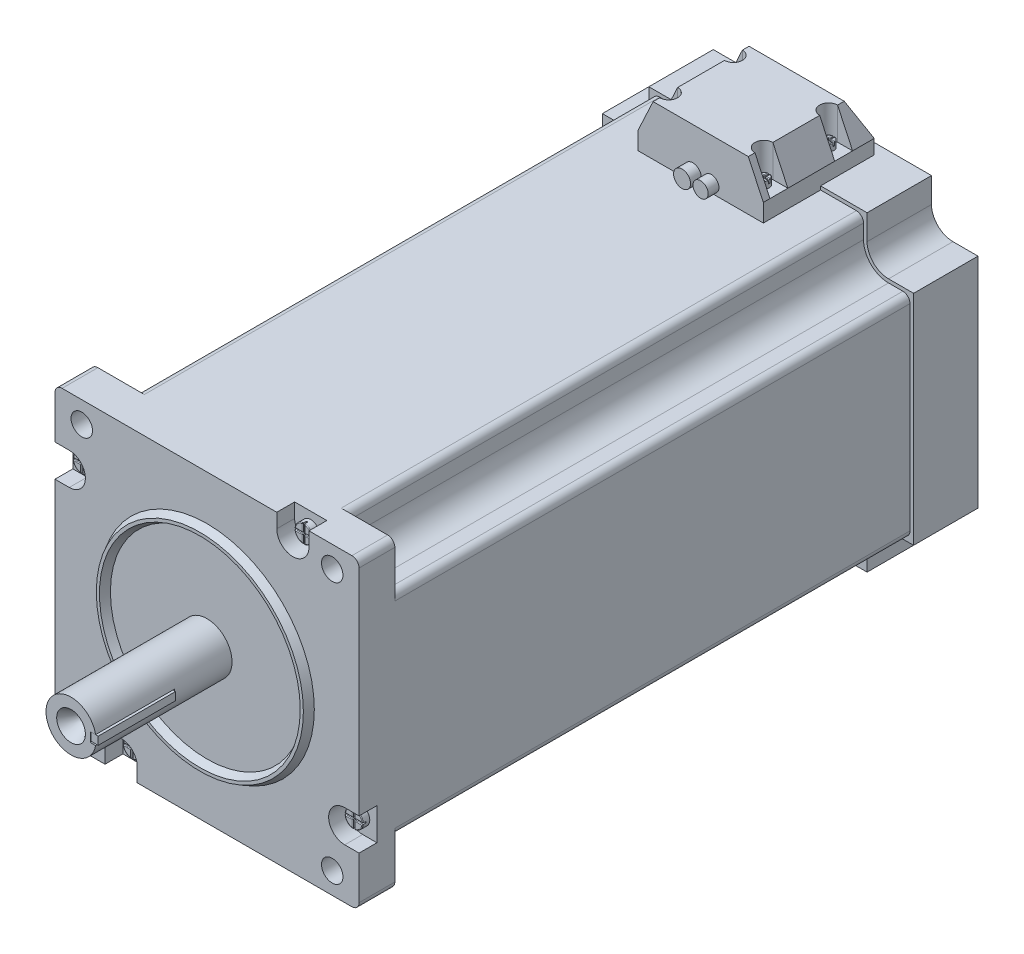
from build123d import *

# Parameters (mm, degrees)
BOSS_EXTRUDE1_DEPTH  = 144
BOSS_EXTRUDE2_START  = 18
BOSS_EXTRUDE2_DEPTH  = 18
SKETCH4_W            = 85
SKETCH4_H            = 85
BOSS_EXTRUDE3_DEPTH  = 10
SKETCH5_R            = 3
CUT_EXTRUDE1_DEPTH   = 10
CUT_EXTRUDE2_DEPTH   = 5
SKETCH7_R            = 30
SKETCH7_R_2          = 27
BOSS_EXTRUDE4_DEPTH  = 2
BOSS_EXTRUDE4_DRAFT  = 28
SKETCH8_R            = 7
BOSS_EXTRUDE5_DEPTH  = 38
SKETCH9_R            = 4.014569365
CUT_EXTRUDE3_DEPTH   = 5
CUT_EXTRUDE3_DRAFT   = -32
SKETCH10_W           = 1.908074337
SKETCH10_H           = 2.63882621
CUT_EXTRUDE4_DEPTH   = 22
SKETCH11_W           = 21.6
SKETCH11_H           = 2.23882621
BOSS_EXTRUDE6_DEPTH  = 2
FILLET1_R            = 2
FILLET2_R            = 2
SKETCH12_R           = 2.5
BOSS_EXTRUDE7_DEPTH  = 2
CUT_EXTRUDE5_START   = -1
CUT_EXTRUDE5_DEPTH   = 1
FILLET3_R            = 0.2
SKETCH14_W           = 35
SKETCH14_H           = 31
BOSS_EXTRUDE8_DEPTH  = 5
SKETCH15_W           = 35
SKETCH15_H           = 31
BOSS_EXTRUDE9_DEPTH  = 9
BOSS_EXTRUDE9_TAPER  = 25
BOSS_EXTRUDE10_REACH = 234.938
SKETCH16_W           = 35
SKETCH16_H           = 4.196768923
CUT_EXTRUDE6_DEPTH   = 4.196768923
SKETCH18_R           = 2.5
CUT_EXTRUDE7_DEPTH   = 9
SKETCH19_W           = 4.524890729
SKETCH19_H           = 5
SKETCH19_W_2         = 5.286669256
SKETCH19_W_3         = 5.176854747
SKETCH19_W_4         = 5.679294717
CUT_EXTRUDE8_DEPTH   = 9
SKETCH20_R           = 1.5
BOSS_EXTRUDE11_DEPTH = 2
CUT_EXTRUDE9_START   = -1
CUT_EXTRUDE9_DEPTH   = 1
FILLET4_R            = 0.2
SKETCH22_R           = 2.372641089
SKETCH22_R_2         = 2.128578972
BOSS_EXTRUDE12_DEPTH = 3


with BuildPart() as part:
    # Sketch1 → Boss-Extrude1 (new body)
    with BuildSketch(Plane.XY):
        with BuildLine():
            Line((13, 0), (72, 0))
            Line((72, 0), (72, 6))
            ThreePointArc((72, 6), (74.050252532, 10.949747468), (79, 13))
            Line((79, 13), (85, 13))
            Line((85, 13), (85, 72))
            Line((85, 72), (79, 72))
            ThreePointArc((79, 72), (74.050252532, 74.050252532), (72, 79))
            Line((72, 79), (72, 85))
            Line((72, 85), (13, 85))
            Line((13, 85), (13, 79))
            ThreePointArc((13, 79), (10.949747468, 74.050252532), (6, 72))
            Line((6, 72), (0, 72))
            Line((0, 72), (0, 13))
            Line((0, 13), (6, 13))
            ThreePointArc((6, 13), (10.949747468, 10.949747468), (13, 6))
            Line((13, 6), (13, 0))
        make_face()
    extrude(amount=BOSS_EXTRUDE1_DEPTH)

    # Sketch2 → Boss-Extrude2 (add)
    # profile 1 of 2: a face of its own
    with BuildSketch(Plane(origin=(0, 0, 0), x_dir=(-1, 0, 0), z_dir=(0, 0, -1)).offset(BOSS_EXTRUDE2_START)):
        with BuildLine():
            ThreePointArc((-6, 12), (-10.242640687, 10.242640687), (-12, 6))
            Line((-12, 6), (-12, -1))
            Line((-12, -1), (-73, -1))
            Line((-73, -1), (-73, 6))
            ThreePointArc((-73, 6), (-74.757359313, 10.242640687), (-79, 12))
            Line((-79, 12), (-86, 12))
            Line((-86, 12), (-86, 73))
            Line((-86, 73), (-79, 73))
            ThreePointArc((-79, 73), (-74.757359313, 74.757359313), (-73, 79))
            Line((-73, 79), (-73, 86))
            Line((-73, 86), (-12, 86))
            Line((-12, 86), (-12, 79))
            ThreePointArc((-12, 79), (-10.242640687, 74.757359313), (-6, 73))
            Line((-6, 73), (1, 73))
            Line((1, 73), (1, 12))
            Line((1, 12), (-6, 12))
        make_face()
        with BuildLine():
            Line((0, 72), (-6, 72))
            ThreePointArc((-6, 72), (-10.949747468, 74.050252532), (-13, 79))
            Line((-13, 79), (-13, 85))
            Line((-13, 85), (-72, 85))
            Line((-72, 85), (-72, 79))
            ThreePointArc((-72, 79), (-74.050252532, 74.050252532), (-79, 72))
            Line((-79, 72), (-85, 72))
            Line((-85, 72), (-85, 13))
            Line((-85, 13), (-79, 13))
            ThreePointArc((-79, 13), (-74.050252532, 10.949747468), (-72, 6))
            Line((-72, 6), (-72, 0))
            Line((-72, 0), (-13, 0))
            Line((-13, 0), (-13, 6))
            ThreePointArc((-13, 6), (-10.949747468, 10.949747468), (-6, 13))
            Line((-6, 13), (0, 13))
            Line((0, 13), (0, 72))
        make_face(mode=Mode.SUBTRACT)
    # profile 2 of 2: a face of its own
    with BuildSketch(Plane(origin=(0, 0, 0), x_dir=(-1, 0, 0), z_dir=(0, 0, -1)).offset(BOSS_EXTRUDE2_START)):
        with BuildLine():
            Line((0, 13), (0, 72))
            Line((0, 72), (-6, 72))
            ThreePointArc((-6, 72), (-10.949747468, 74.050252532), (-13, 79))
            Line((-13, 79), (-13, 85))
            Line((-13, 85), (-72, 85))
            Line((-72, 85), (-72, 79))
            ThreePointArc((-72, 79), (-74.050252532, 74.050252532), (-79, 72))
            Line((-79, 72), (-85, 72))
            Line((-85, 72), (-85, 13))
            Line((-85, 13), (-79, 13))
            ThreePointArc((-79, 13), (-74.050252532, 10.949747468), (-72, 6))
            Line((-72, 6), (-72, 0))
            Line((-72, 0), (-13, 0))
            Line((-13, 0), (-13, 6))
            ThreePointArc((-13, 6), (-10.949747468, 10.949747468), (-6, 13))
            Line((-6, 13), (0, 13))
        make_face()
    extrude(amount=-BOSS_EXTRUDE2_DEPTH)

    # Sketch4 → Boss-Extrude3 (add)
    with BuildSketch(Plane.XY.offset(144)):
        with Locations((42.5, 42.5)):
            Rectangle(SKETCH4_W, SKETCH4_H)
    extrude(amount=BOSS_EXTRUDE3_DEPTH)

    # Sketch5 → Cut-Extrude1 (cut)
    with BuildSketch(Plane.XY.offset(154)):
        with Locations((7.5, 79)):
            Circle(SKETCH5_R)
        with Locations(Location((77.5, 79, 0), (0, 0, 180))):
            Circle(SKETCH5_R)
        with Locations((77.5, 6)):
            Circle(SKETCH5_R)
        with Locations(Location((7.5, 6, 0), (0, 0, 180))):
            Circle(SKETCH5_R)
    extrude(amount=-CUT_EXTRUDE1_DEPTH, mode=Mode.SUBTRACT)

    # Sketch6 → Cut-Extrude2 (cut)
    with BuildSketch(Plane.XY.offset(154)):
        with BuildLine():
            Line((0, 71), (4, 71))
            ThreePointArc((4, 71), (8.5, 66.5), (4, 62))
            Line((4, 62), (0, 62))
            Line((0, 62), (0, 71))
        make_face()
        with BuildLine():
            Line((62, 85), (62, 81))
            ThreePointArc((62, 81), (66.5, 76.5), (71, 81))
            Line((71, 81), (71, 85))
            Line((71, 85), (62, 85))
        make_face()
        with BuildLine():
            Line((85, 23), (81, 23))
            ThreePointArc((81, 23), (76.5, 18.5), (81, 14))
            Line((81, 14), (85, 14))
            Line((85, 14), (85, 23))
        make_face()
        with BuildLine():
            Line((23, 0), (23, 4))
            ThreePointArc((23, 4), (18.5, 8.5), (14, 4))
            Line((14, 4), (14, 0))
            Line((14, 0), (23, 0))
        make_face()
    extrude(amount=-CUT_EXTRUDE2_DEPTH, mode=Mode.SUBTRACT)


with BuildPart() as boss_extrude4_tool:
    # Sketch7 → Boss-Extrude4 (with draft: the straight prism first)
    with BuildSketch(Plane.XY.offset(154)):
        with Locations((42.5, 42.5)):
            Circle(SKETCH7_R)
        with Locations((42.5, 42.5)):
            Circle(SKETCH7_R_2, mode=Mode.SUBTRACT)
    extrude(amount=BOSS_EXTRUDE4_DEPTH)
    # Boss-Extrude4: the draft: its side faces are tilted about the plane it starts from
    boss_extrude4_sides = [boss_extrude4_tool.faces().sort_by_distance(p)[0] for p in [
        (12.5, 42.5, 155),
        (15.5, 42.5, 155),
    ]]
    draft(boss_extrude4_sides, Plane.XY.offset(154), BOSS_EXTRUDE4_DRAFT)


with BuildPart() as part_1:
    add(part.part)

    # Boss-Extrude4: add boss_extrude4_tool
    add(boss_extrude4_tool.part)

    # Sketch8 → Boss-Extrude5 (add)
    with BuildSketch(Plane.XY.offset(154)):
        with Locations(Location((42.5, 42.5, 0), (0, 0, 180))):
            Circle(SKETCH8_R)
    extrude(amount=BOSS_EXTRUDE5_DEPTH)


with BuildPart() as cut_extrude3_tool:
    # Sketch9 → Cut-Extrude3 (with draft: the straight prism first)
    with BuildSketch(Plane.XY.offset(192)):
        with Locations((42.5, 42.5)):
            Circle(SKETCH9_R)
    extrude(amount=-CUT_EXTRUDE3_DEPTH)
    # Cut-Extrude3: the draft: its side faces are tilted about the plane it starts from
    cut_extrude3_sides = [cut_extrude3_tool.faces().sort_by_distance(p)[0] for p in [
        (38.485430635, 42.5, 189.5),
    ]]
    draft(cut_extrude3_sides, Plane.XY.offset(192), CUT_EXTRUDE3_DRAFT)


with BuildPart() as part_2:
    add(part_1.part)

    # Cut-Extrude3: cut by cut_extrude3_tool
    add(cut_extrude3_tool.part, mode=Mode.SUBTRACT)

    # Sketch10 → Cut-Extrude4 (cut)
    with BuildSketch(Plane.XY.offset(192)):
        with Locations((48.841652855, 42.534301843)):
            Rectangle(SKETCH10_W, SKETCH10_H)
    extrude(amount=-CUT_EXTRUDE4_DEPTH, mode=Mode.SUBTRACT)

    # Sketch11 → Boss-Extrude6 (add)
    with BuildSketch(Plane(origin=(47.887615686, 0, 0), x_dir=(0, 0, -1), z_dir=(1, 0, 0))):
        with Locations((-181, 42.534301843)):
            Rectangle(SKETCH11_W, SKETCH11_H)
    extrude(amount=BOSS_EXTRUDE6_DEPTH)

    # Fillet1
    fillet1_edges = [part_2.edges().sort_by_distance(p)[0] for p in [
        (85, 0, 149),
        (85, 85, 149),
        (0, 85, 149),
        (0, 0, 149),
    ]]
    fillet(fillet1_edges, radius=FILLET1_R)

    # Fillet2
    fillet2_edges = [part_2.edges().sort_by_distance(p)[0] for p in [
        (13, 85, 72),
        (72, 85, 72),
        (85, 72, 72),
        (85, 13, 72),
        (72, 0, 72),
        (13, 0, 72),
        (0, 13, 72),
        (0, 72, 72),
    ]]
    fillet(fillet2_edges, radius=FILLET2_R)

    # Sketch12 → Boss-Extrude7 (add)
    with BuildSketch(Plane.XY.offset(149)):
        with Locations((66.5, 80.498389003)):
            Circle(SKETCH12_R)
        with Locations((80.498389003, 18.5)):
            Circle(SKETCH12_R)
        with Locations((18.5, 4.501610997)):
            Circle(SKETCH12_R)
        with Locations((4.501610997, 66.5)):
            Circle(SKETCH12_R)
    extrude(amount=BOSS_EXTRUDE7_DEPTH)

    # Sketch13 → Cut-Extrude5 (cut)
    with BuildSketch(Plane.XY.offset(151).offset(CUT_EXTRUDE5_START)):
        with BuildLine():
            ThreePointArc((64.008012841, 80.698389003), (64, 80.498389003), (64.008012841, 80.298389003))
            Line((64.008012841, 80.298389003), (66.3, 80.298389003))
            Line((66.3, 80.298389003), (66.3, 78.006401844))
            ThreePointArc((66.3, 78.006401844), (66.5, 77.998389003), (66.7, 78.006401844))
            Line((66.7, 78.006401844), (66.7, 80.298389003))
            Line((66.7, 80.298389003), (68.991987159, 80.298389003))
            ThreePointArc((68.991987159, 80.298389003), (68.997995987, 80.398308778), (69, 80.498389003))
            ThreePointArc((69, 80.498389003), (68.997995987, 80.598469228), (68.991987159, 80.698389003))
            Line((68.991987159, 80.698389003), (66.7, 80.698389003))
            Line((66.7, 80.698389003), (66.7, 82.990376162))
            ThreePointArc((66.7, 82.990376162), (66.5, 82.998389003), (66.3, 82.990376162))
            Line((66.3, 82.990376162), (66.3, 80.698389003))
            Line((66.3, 80.698389003), (64.008012841, 80.698389003))
        make_face()
        with BuildLine():
            Line((4.301610997, 66.7), (2.009623838, 66.7))
            ThreePointArc((2.009623838, 66.7), (2.001610997, 66.5), (2.009623838, 66.3))
            Line((2.009623838, 66.3), (4.301610997, 66.3))
            Line((4.301610997, 66.3), (4.301610997, 64.008012841))
            ThreePointArc((4.301610997, 64.008012841), (4.501610997, 64), (4.701610997, 64.008012841))
            Line((4.701610997, 64.008012841), (4.701610997, 66.3))
            Line((4.701610997, 66.3), (6.993598156, 66.3))
            ThreePointArc((6.993598156, 66.3), (6.999606984, 66.399919775), (7.001610997, 66.5))
            ThreePointArc((7.001610997, 66.5), (6.999606984, 66.600080225), (6.993598156, 66.7))
            Line((6.993598156, 66.7), (4.701610997, 66.7))
            Line((4.701610997, 66.7), (4.701610997, 68.991987159))
            ThreePointArc((4.701610997, 68.991987159), (4.501610997, 69), (4.301610997, 68.991987159))
            Line((4.301610997, 68.991987159), (4.301610997, 66.7))
        make_face()
        with BuildLine():
            Line((18.3, 4.301610997), (18.3, 2.009623838))
            ThreePointArc((18.3, 2.009623838), (18.5, 2.001610997), (18.7, 2.009623838))
            Line((18.7, 2.009623838), (18.7, 4.301610997))
            Line((18.7, 4.301610997), (20.991987159, 4.301610997))
            ThreePointArc((20.991987159, 4.301610997), (20.997995987, 4.401530772), (21, 4.501610997))
            ThreePointArc((21, 4.501610997), (20.997995987, 4.601691222), (20.991987159, 4.701610997))
            Line((20.991987159, 4.701610997), (18.7, 4.701610997))
            Line((18.7, 4.701610997), (18.7, 6.993598156))
            ThreePointArc((18.7, 6.993598156), (18.5, 7.001610997), (18.3, 6.993598156))
            Line((18.3, 6.993598156), (18.3, 4.701610997))
            Line((18.3, 4.701610997), (16.008012841, 4.701610997))
            ThreePointArc((16.008012841, 4.701610997), (16, 4.501610997), (16.008012841, 4.301610997))
            Line((16.008012841, 4.301610997), (18.3, 4.301610997))
        make_face()
        with BuildLine():
            Line((80.698389003, 18.3), (82.990376162, 18.3))
            ThreePointArc((82.990376162, 18.3), (82.996384989, 18.399919775), (82.998389003, 18.5))
            ThreePointArc((82.998389003, 18.5), (82.996384989, 18.600080225), (82.990376162, 18.7))
            Line((82.990376162, 18.7), (80.698389003, 18.7))
            Line((80.698389003, 18.7), (80.698389003, 20.991987159))
            ThreePointArc((80.698389003, 20.991987159), (80.498389003, 21), (80.298389003, 20.991987159))
            Line((80.298389003, 20.991987159), (80.298389003, 18.7))
            Line((80.298389003, 18.7), (78.006401844, 18.7))
            ThreePointArc((78.006401844, 18.7), (77.998389003, 18.5), (78.006401844, 18.3))
            Line((78.006401844, 18.3), (80.298389003, 18.3))
            Line((80.298389003, 18.3), (80.298389003, 16.008012841))
            ThreePointArc((80.298389003, 16.008012841), (80.498389003, 16), (80.698389003, 16.008012841))
            Line((80.698389003, 16.008012841), (80.698389003, 18.3))
        make_face()
    extrude(amount=CUT_EXTRUDE5_DEPTH, mode=Mode.SUBTRACT)

    # Fillet3
    fillet3_edges = [part_2.edges().sort_by_distance(p)[0] for p in [
        (68.267766953, 82.266155956, 151),
        (82.266155956, 20.267766953, 151),
        (20.267766953, 6.26937795, 151),
        (6.26937795, 68.267766953, 151),
        (2.733844044, 68.267766953, 151),
        (2.733844044, 64.732233047, 151),
        (6.26937795, 64.732233047, 151),
        (16.732233047, 6.26937795, 151),
        (16.732233047, 2.733844044, 151),
        (20.267766953, 2.733844044, 151),
        (78.73062205, 20.267766953, 151),
        (78.73062205, 16.732233047, 151),
        (82.266155956, 16.732233047, 151),
        (64.732233047, 82.266155956, 151),
        (64.732233047, 78.73062205, 151),
        (68.267766953, 78.73062205, 151),
        (66.7, 79.152395424, 151),
        (65.154006421, 80.698389003, 151),
        (66.7, 81.844382582, 151),
        (67.845993579, 80.698389003, 151),
        (67.845993579, 80.298389003, 151),
        (66.3, 81.844382582, 151),
        (65.154006421, 80.298389003, 151),
        (66.3, 79.152395424, 151),
        (5.847604576, 66.7, 151),
        (4.301610997, 65.154006421, 151),
        (3.155617418, 66.7, 151),
        (4.301610997, 67.845993579, 151),
        (4.701610997, 67.845993579, 151),
        (3.155617418, 66.3, 151),
        (4.701610997, 65.154006421, 151),
        (5.847604576, 66.3, 151),
        (19.845993579, 4.301610997, 151),
        (18.3, 3.155617418, 151),
        (17.154006421, 4.301610997, 151),
        (18.3, 5.847604576, 151),
        (18.7, 5.847604576, 151),
        (17.154006421, 4.701610997, 151),
        (18.7, 3.155617418, 151),
        (19.845993579, 4.701610997, 151),
        (80.698389003, 19.845993579, 151),
        (81.844382582, 18.3, 151),
        (80.698389003, 17.154006421, 151),
        (79.152395424, 18.3, 151),
        (80.298389003, 19.845993579, 151),
        (79.152395424, 18.7, 151),
        (80.298389003, 17.154006421, 151),
        (81.844382582, 18.7, 151),
    ]]
    fillet(fillet3_edges, radius=FILLET3_R)

    # Sketch14 → Boss-Extrude8 (add)
    with BuildSketch(Plane(origin=(0, 85, 0), x_dir=(1, 0, 0), z_dir=(0, 1, 0))):
        with Locations((42.5, -0.5)):
            Rectangle(SKETCH14_W, SKETCH14_H)
    extrude(amount=BOSS_EXTRUDE8_DEPTH)

    # Sketch15 → Boss-Extrude9 (add)
    with BuildSketch(Plane(origin=(0, 90, 0), x_dir=(1, 0, 0), z_dir=(0, 1, 0))):
        with Locations((42.5, -0.5)):
            Rectangle(SKETCH15_W, SKETCH15_H)
    extrude(amount=BOSS_EXTRUDE9_DEPTH, taper=BOSS_EXTRUDE9_TAPER)

    # Boss-Extrude10: up to this face of the body (flat: up to its plane)
    boss_extrude10_end = Plane(part_2.part.faces().sort_by_distance((42.367076923, 85, 83.647076923))[0])
    # Sketch16 → Boss-Extrude10 (add, up to the picked face)
    with BuildSketch(Plane(origin=(0, 99, 0), x_dir=(1, 0, 0), z_dir=(0, 1, 0)), mode=Mode.PRIVATE) as boss_extrude10_sk1:
        with Locations((42.5, -13.901615538)):
            Rectangle(SKETCH16_W, SKETCH16_H)
    boss_extrude10_tool1 = split(extrude(boss_extrude10_sk1.sketch, amount=-BOSS_EXTRUDE10_REACH, mode=Mode.PRIVATE), bisect_by=boss_extrude10_end, keep=Keep.BOTH, mode=Mode.PRIVATE)
    add(boss_extrude10_tool1.solids().sort_by(Axis((42.5, 99, 13.901616), (0, -1, 0)))[0])

    # Sketch17 → Cut-Extrude6 (cut)
    with BuildSketch(Plane(origin=(0, 0, 11.803231077), x_dir=(-1, 0, 0), z_dir=(0, 0, -1))):
        Polygon((-60, 90), (-55.803231077, 99), (-60, 99), align=None)
        Polygon((-29.196768923, 99), (-25, 90), (-25, 99), align=None)
    extrude(amount=-CUT_EXTRUDE6_DEPTH, mode=Mode.SUBTRACT)

    # Sketch18 → Cut-Extrude7 (cut)
    with BuildSketch(Plane(origin=(0, 99, 0), x_dir=(1, 0, 0), z_dir=(0, 1, 0))):
        with Locations(Location((55.803231077, 6.448931168, 0), (0, 0, 270))):
            Circle(SKETCH18_R)
        with Locations(Location((29.196768923, 6.448931168, 0), (0, 0, 90))):
            Circle(SKETCH18_R)
        with Locations(Location((29.196768923, -11.645700091, 0), (0, 0, 270))):
            Circle(SKETCH18_R)
        with Locations(Location((55.803231077, -11.645700091, 0), (0, 0, 90))):
            Circle(SKETCH18_R)
    extrude(amount=-CUT_EXTRUDE7_DEPTH, mode=Mode.SUBTRACT)

    # Sketch19 → Cut-Extrude8 (cut)
    with BuildSketch(Plane(origin=(0, 99, 0), x_dir=(1, 0, 0), z_dir=(0, 1, 0))):
        with Locations((58.065676442, -11.645700091)):
            Rectangle(SKETCH19_W, SKETCH19_H)
        with Locations((58.446565705, 6.448931168)):
            Rectangle(SKETCH19_W_2, SKETCH19_H)
        with Locations((26.60834155, 6.448931168)):
            Rectangle(SKETCH19_W_3, SKETCH19_H)
        with Locations((26.357121565, -11.645700091)):
            Rectangle(SKETCH19_W_4, SKETCH19_H)
    extrude(amount=-CUT_EXTRUDE8_DEPTH, mode=Mode.SUBTRACT)

    # Sketch20 → Boss-Extrude11 (add)
    with BuildSketch(Plane(origin=(0, 90, 0), x_dir=(1, 0, 0), z_dir=(0, 1, 0))):
        with Locations(Location((55.803231077, 6.448931168, 0), (0, 0, 270))):
            Circle(SKETCH20_R)
        with Locations(Location((55.803231077, -11.645700091, 0), (0, 0, 90))):
            Circle(SKETCH20_R)
        with Locations(Location((29.196768923, -11.645700091, 0), (0, 0, 270))):
            Circle(SKETCH20_R)
        with Locations(Location((29.196768923, 6.448931168, 0), (0, 0, 90))):
            Circle(SKETCH20_R)
    extrude(amount=BOSS_EXTRUDE11_DEPTH)

    # Sketch21 → Cut-Extrude9 (cut)
    with BuildSketch(Plane(origin=(0, 92, 0), x_dir=(1, 0, 0), z_dir=(0, 1, 0)).offset(CUT_EXTRUDE9_START)):
        with BuildLine():
            Line((30.683375798, -11.445700091), (29.396768923, -11.445700091))
            Line((29.396768923, -11.445700091), (29.396768923, -10.159093216))
            ThreePointArc((29.396768923, -10.159093216), (29.196768923, -10.145700091), (28.996768923, -10.159093216))
            Line((28.996768923, -10.159093216), (28.996768923, -11.445700091))
            Line((28.996768923, -11.445700091), (27.710162049, -11.445700091))
            ThreePointArc((27.710162049, -11.445700091), (27.696768923, -11.645700091), (27.710162049, -11.845700091))
            Line((27.710162049, -11.845700091), (28.996768923, -11.845700091))
            Line((28.996768923, -11.845700091), (28.996768923, -13.132306966))
            ThreePointArc((28.996768923, -13.132306966), (29.196768923, -13.145700091), (29.396768923, -13.132306966))
            Line((29.396768923, -13.132306966), (29.396768923, -11.845700091))
            Line((29.396768923, -11.845700091), (30.683375798, -11.845700091))
            ThreePointArc((30.683375798, -11.845700091), (30.696768923, -11.645700091), (30.683375798, -11.445700091))
        make_face()
        with BuildLine():
            ThreePointArc((27.710162049, 6.648931168), (27.696768923, 6.448931168), (27.710162049, 6.248931168))
            Line((27.710162049, 6.248931168), (28.996768923, 6.248931168))
            Line((28.996768923, 6.248931168), (28.996768923, 4.962324293))
            ThreePointArc((28.996768923, 4.962324293), (29.196768923, 4.948931168), (29.396768923, 4.962324293))
            Line((29.396768923, 4.962324293), (29.396768923, 6.248931168))
            Line((29.396768923, 6.248931168), (30.683375798, 6.248931168))
            ThreePointArc((30.683375798, 6.248931168), (30.693416897, 6.348707199), (30.696768923, 6.448931168))
            ThreePointArc((30.696768923, 6.448931168), (30.693416897, 6.549155137), (30.683375798, 6.648931168))
            Line((30.683375798, 6.648931168), (29.396768923, 6.648931168))
            Line((29.396768923, 6.648931168), (29.396768923, 7.935538043))
            ThreePointArc((29.396768923, 7.935538043), (29.196768923, 7.948931168), (28.996768923, 7.935538043))
            Line((28.996768923, 7.935538043), (28.996768923, 6.648931168))
            Line((28.996768923, 6.648931168), (27.710162049, 6.648931168))
        make_face()
        with BuildLine():
            ThreePointArc((57.289837951, -11.845700091), (57.303231077, -11.645700091), (57.289837951, -11.445700091))
            Line((57.289837951, -11.445700091), (56.003231077, -11.445700091))
            Line((56.003231077, -11.445700091), (56.003231077, -10.159093216))
            ThreePointArc((56.003231077, -10.159093216), (55.803231077, -10.145700091), (55.603231077, -10.159093216))
            Line((55.603231077, -10.159093216), (55.603231077, -11.445700091))
            Line((55.603231077, -11.445700091), (54.316624202, -11.445700091))
            ThreePointArc((54.316624202, -11.445700091), (54.303231077, -11.645700091), (54.316624202, -11.845700091))
            Line((54.316624202, -11.845700091), (55.603231077, -11.845700091))
            Line((55.603231077, -11.845700091), (55.603231077, -13.132306966))
            ThreePointArc((55.603231077, -13.132306966), (55.803231077, -13.145700091), (56.003231077, -13.132306966))
            Line((56.003231077, -13.132306966), (56.003231077, -11.845700091))
            Line((56.003231077, -11.845700091), (57.289837951, -11.845700091))
        make_face()
        with BuildLine():
            Line((54.316624202, 6.248931168), (55.603231077, 6.248931168))
            Line((55.603231077, 6.248931168), (55.603231077, 4.962324293))
            ThreePointArc((55.603231077, 4.962324293), (55.803231077, 4.948931168), (56.003231077, 4.962324293))
            Line((56.003231077, 4.962324293), (56.003231077, 6.248931168))
            Line((56.003231077, 6.248931168), (57.289837951, 6.248931168))
            ThreePointArc((57.289837951, 6.248931168), (57.303231077, 6.448931168), (57.289837951, 6.648931168))
            Line((57.289837951, 6.648931168), (56.003231077, 6.648931168))
            Line((56.003231077, 6.648931168), (56.003231077, 7.935538043))
            ThreePointArc((56.003231077, 7.935538043), (55.803231077, 7.948931168), (55.603231077, 7.935538043))
            Line((55.603231077, 7.935538043), (55.603231077, 6.648931168))
            Line((55.603231077, 6.648931168), (54.316624202, 6.648931168))
            ThreePointArc((54.316624202, 6.648931168), (54.303231077, 6.448931168), (54.316624202, 6.248931168))
        make_face()
    extrude(amount=CUT_EXTRUDE9_DEPTH, mode=Mode.SUBTRACT)

    # Fillet4
    fillet4_edges = [part_2.edges().sort_by_distance(p)[0] for p in [
        (56.863891248, 92, -5.388270996),
        (56.863891248, 92, 12.706360263),
        (30.257429095, 92, 12.706360263),
        (30.257429095, 92, -5.388270996),
        (30.257429095, 92, -7.50959134),
        (28.136108752, 92, -7.50959134),
        (28.136108752, 92, -5.388270996),
        (30.257429095, 92, 10.585039919),
        (28.136108752, 92, 10.585039919),
        (28.136108752, 92, 12.706360263),
        (56.863891248, 92, 10.585039919),
        (54.742570905, 92, 10.585039919),
        (54.742570905, 92, 12.706360263),
        (56.863891248, 92, -7.50959134),
        (54.742570905, 92, -7.50959134),
        (54.742570905, 92, -5.388270996),
        (29.396768923, 92, -5.60562773),
        (28.353465486, 92, -6.648931168),
        (29.396768923, 92, -7.292234605),
        (30.040072361, 92, -6.648931168),
        (30.040072361, 92, -6.248931168),
        (28.996768923, 92, -7.292234605),
        (28.353465486, 92, -6.248931168),
        (28.996768923, 92, -5.60562773),
        (55.603231077, 92, 12.489003529),
        (54.959927639, 92, 11.845700091),
        (55.603231077, 92, 10.802396654),
        (56.646534514, 92, 11.845700091),
        (56.003231077, 92, 12.489003529),
        (56.646534514, 92, 11.445700091),
        (56.003231077, 92, 10.802396654),
        (54.959927639, 92, 11.445700091),
        (54.959927639, 92, -6.248931168),
        (56.003231077, 92, -7.292234605),
        (56.646534514, 92, -6.248931168),
        (56.003231077, 92, -5.60562773),
        (56.646534514, 92, -6.648931168),
        (55.603231077, 92, -7.292234605),
        (54.959927639, 92, -6.648931168),
        (55.603231077, 92, -5.60562773),
        (30.040072361, 92, 11.445700091),
        (28.996768923, 92, 12.489003529),
        (28.353465486, 92, 11.445700091),
        (28.996768923, 92, 10.802396654),
        (28.353465486, 92, 11.845700091),
        (29.396768923, 92, 12.489003529),
        (30.040072361, 92, 11.845700091),
        (29.396768923, 92, 10.802396654),
    ]]
    fillet(fillet4_edges, radius=FILLET4_R)

    # Sketch22 → Boss-Extrude12 (add)
    with BuildSketch(Plane.XY.offset(16)):
        with Locations((40.288819231, 87.36561673)):
            Circle(SKETCH22_R)
        with Locations(Location((45.459427903, 87.36561673, 0), (0, 0, 180))):
            Circle(SKETCH22_R_2)
    extrude(amount=BOSS_EXTRUDE12_DEPTH)


solid = part_2.part
